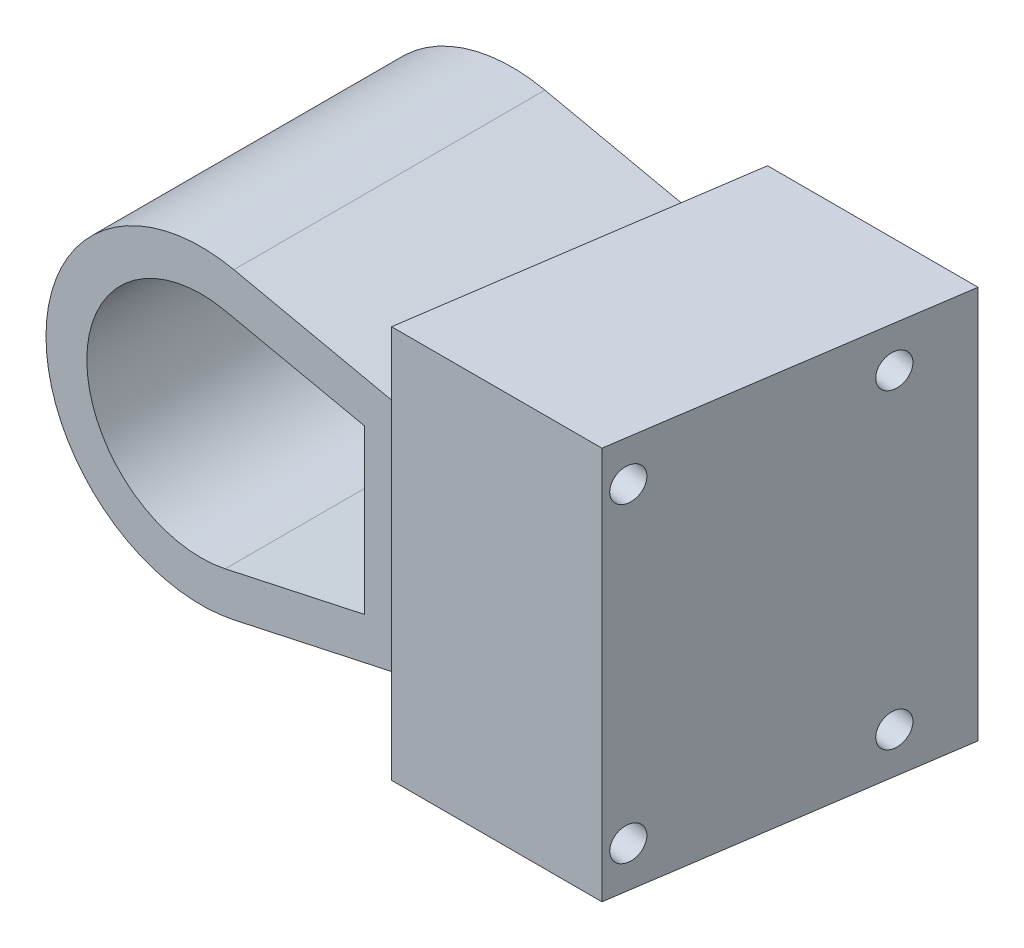
from build123d import *

# Parameters (mm, degrees)
BOSS_EXTRUDE1_DEPTH      = 38
BOSS_EXTRUDE2_DEPTH      = 14
BOSS_EXTRUDE5_DEPTH      = 10
BOSS_EXTRUDE5_DEPTH_BACK = 38
SKETCH6_R                = 2
CUT_EXTRUDE2_DEPTH       = 36


with BuildPart() as part:
    # Sketch1 → Boss-Extrude1 (new body)
    with BuildSketch(Plane.XY):
        with BuildLine():
            Line((22.631743337, -14.12565234), (22.631743337, 13.87434766))
            Line((22.631743337, 13.87434766), (1.698298535, 18.39987252))
            ThreePointArc((1.698298535, 18.39987252), (-0.292783652, 18.720543399), (-2.306666921, 18.827838622))
            ThreePointArc((-2.306666921, 18.827838622), (-21.260157884, -0.12565234), (-2.306666921, -19.079143303))
            ThreePointArc((-2.306666921, -19.079143303), (-0.292783652, -18.971848079), (1.698298535, -18.651177201))
            Line((1.698298535, -18.651177201), (22.631743337, -14.12565234))
        make_face()
        with BuildLine():
            Line((17.644061285, -10.101016443), (17.644061285, 9.849711763))
            Line((17.644061285, 9.849711763), (0.644376893, 13.52481135))
            ThreePointArc((0.644376893, 13.52481135), (-0.822744568, 13.761096487), (-2.306666921, 13.840156571))
            ThreePointArc((-2.306666921, 13.840156571), (-16.272475832, -0.12565234), (-2.306666921, -14.091461251))
            ThreePointArc((-2.306666921, -14.091461251), (-0.822744568, -14.012401167), (0.644376893, -13.77611603))
            Line((0.644376893, -13.77611603), (17.644061285, -10.101016443))
        make_face(mode=Mode.SUBTRACT)
    extrude(amount=BOSS_EXTRUDE1_DEPTH)

    # Sketch2 → Boss-Extrude2 (add, symmetric)
    with BuildSketch(Plane(origin=(0, 0, 0), x_dir=(1, 0, 0), z_dir=(0, 1, 0))):
        Polygon((22.631743337, -38), (22.631743337, 0), (48.276983868, 0), (42.631743337, -38), align=None)
    extrude(amount=BOSS_EXTRUDE2_DEPTH, both=True)

    # Sketch4 → Boss-Extrude5 (add, two sides: drawn at the far end of the back side and taken through both)
    with BuildSketch(Plane(origin=(0, 14, 0), x_dir=(1, 0, 0), z_dir=(0, 1, 0)).offset(-BOSS_EXTRUDE5_DEPTH_BACK)):
        Polygon((28.899463429, 0), (22.957104975, -40), (48.666190602, -40), (54.608549056, 0), align=None)
    extrude(amount=BOSS_EXTRUDE5_DEPTH + BOSS_EXTRUDE5_DEPTH_BACK)

    # Sketch6 → Cut-Extrude2 (cut)
    with BuildSketch(Plane(origin=(28.275431305, 0, 4.200568706), x_dir=(-0.14694627579900546, 0, 0.9891444748007253), z_dir=(-0.9891444748007252, 0, -0.14694627579900543))):
        with Locations((0.974565013, 19)):
            Circle(SKETCH6_R)
        with Locations((29.583142195, 19)):
            Circle(SKETCH6_R)
        with Locations((0.974565013, -19)):
            Circle(SKETCH6_R)
        with Locations((29.583142195, -19)):
            Circle(SKETCH6_R)
    extrude(amount=-CUT_EXTRUDE2_DEPTH, mode=Mode.SUBTRACT)


solid = part.part
